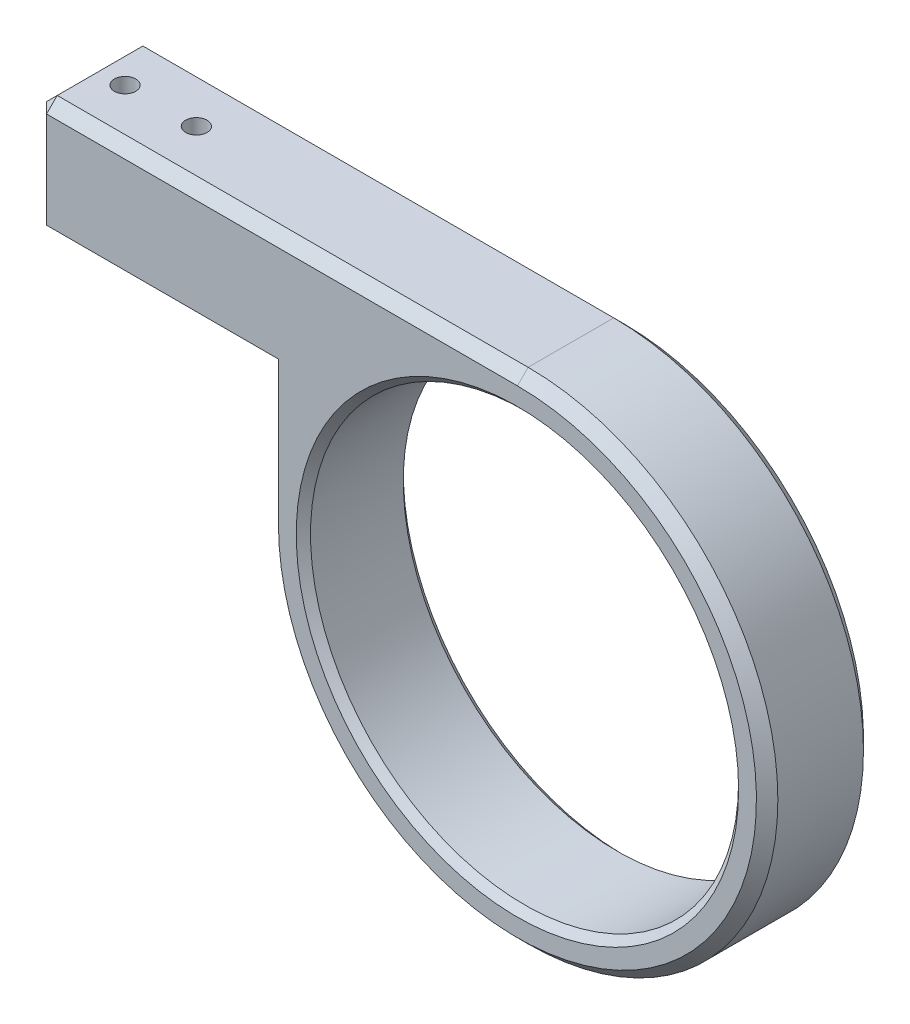
from build123d import *

# Parameters (mm, degrees)
SKETCH_1_R           = 35
EXTRUDE_1_DEPTH      = 15
SKETCH_2_R           = 30
CUT_EXTRUDE_1_DEPTH  = 52.720402164
EXTRUDE_2_REACH      = 81.687
EXTRUDE_2_END_RADIUS = 35
SKETCH_3_W           = 15
SKETCH_3_H           = 15
SKETCH_4_W           = 15
SKETCH_4_H           = 15
EXTRUDE_3_DEPTH      = 32.5
EXTRUDE_4_REACH      = 81.687
SKETCH_6_W           = 15
SKETCH_6_H           = 20
SKETCH_7_R           = 1.5
CUT_EXTRUDE_2_DEPTH  = 89.352985235
CHAMFER_1_SIZE       = 1
CHAMFER_2_SIZE       = 1.5


with BuildPart() as part:
    # 草图1 → 凸台-拉伸1 (new body)
    with BuildSketch(Plane.XY):
        Circle(SKETCH_1_R)
    extrude(amount=EXTRUDE_1_DEPTH)

    # 草图2 → 切除-拉伸1 (cut, through all)
    with BuildSketch(Plane(origin=(0, 0, 0), x_dir=(-1, 0, 0), z_dir=(0, 0, -1))):
        Circle(SKETCH_2_R)
    extrude(amount=-CUT_EXTRUDE_1_DEPTH, mode=Mode.SUBTRACT)

    # 凸台-拉伸2: up to this cylinder (the profile starts outside it)
    extrude_2_end = Plane(origin=(0, 0, 7.5), z_dir=(0, 0, -1)) * Cylinder(EXTRUDE_2_END_RADIUS, 234.374, mode=Mode.PRIVATE)
    # 草图3 → 凸台-拉伸2 (add, up to the surface)
    with BuildSketch(Plane.ZY.offset(35), mode=Mode.PRIVATE) as extrude_2_sk1:
        with Locations((7.5, 27.5)):
            Rectangle(SKETCH_3_W, SKETCH_3_H)
    extrude_2_tool1 = extrude(extrude_2_sk1.sketch, amount=-EXTRUDE_2_REACH, mode=Mode.PRIVATE) - extrude_2_end
    add(extrude_2_tool1.solids().sort_by_distance((-35, 27.5, 7.5))[0])

    # 草图4 → 凸台-拉伸3 (add)
    with BuildSketch(Plane.ZY.offset(35)):
        with Locations((7.5, 27.5)):
            Rectangle(SKETCH_4_W, SKETCH_4_H)
    extrude(amount=EXTRUDE_3_DEPTH)

    # 草图6 → 凸台-拉伸4 (add, up to next)
    with BuildSketch(Plane.ZY.offset(35), mode=Mode.PRIVATE) as extrude_4_sk1:
        with Locations((7.5, 10)):
            Rectangle(SKETCH_6_W, SKETCH_6_H)
    extrude_4_tool1 = extrude(extrude_4_sk1.sketch, amount=-EXTRUDE_4_REACH, mode=Mode.PRIVATE) - part.part
    add(extrude_4_tool1.solids().sort_by_distance((-35, 10, 7.5))[0])

    # 草图7 → 切除-拉伸2 (cut, through all)
    with BuildSketch(Plane.XZ.offset(-20)):
        with Locations(Location((-62.5, 7.5, 0), (0, 0, 270))):
            Circle(SKETCH_7_R)
        with Locations(Location((-52.5, 7.5, 0), (0, 0, 270))):
            Circle(SKETCH_7_R)
    extrude(amount=-CUT_EXTRUDE_2_DEPTH, mode=Mode.SUBTRACT)

    # 倒角1
    chamfer_1_edges = [part.edges().sort_by_distance(p)[0] for p in [
        (30, 0, 15),
        (30, 0, 0),
    ]]
    chamfer(chamfer_1_edges, length=CHAMFER_1_SIZE)

    # 倒角2
    chamfer_2_edges = [part.edges().sort_by_distance(p)[0] for p in [
        (-33.75, 35, 15),
        (-33.75, 35, 0),
        (-67.5, 27.5, 0),
        (-67.5, 27.5, 15),
        (-67.5, 35, 7.5),
        (24.748737342, -24.748737342, 0),
        (24.748737342, -24.748737342, 15),
        (-35, 10, 0),
        (-35, 10, 15),
    ]]
    chamfer(chamfer_2_edges, length=CHAMFER_2_SIZE)


solid = part.part
